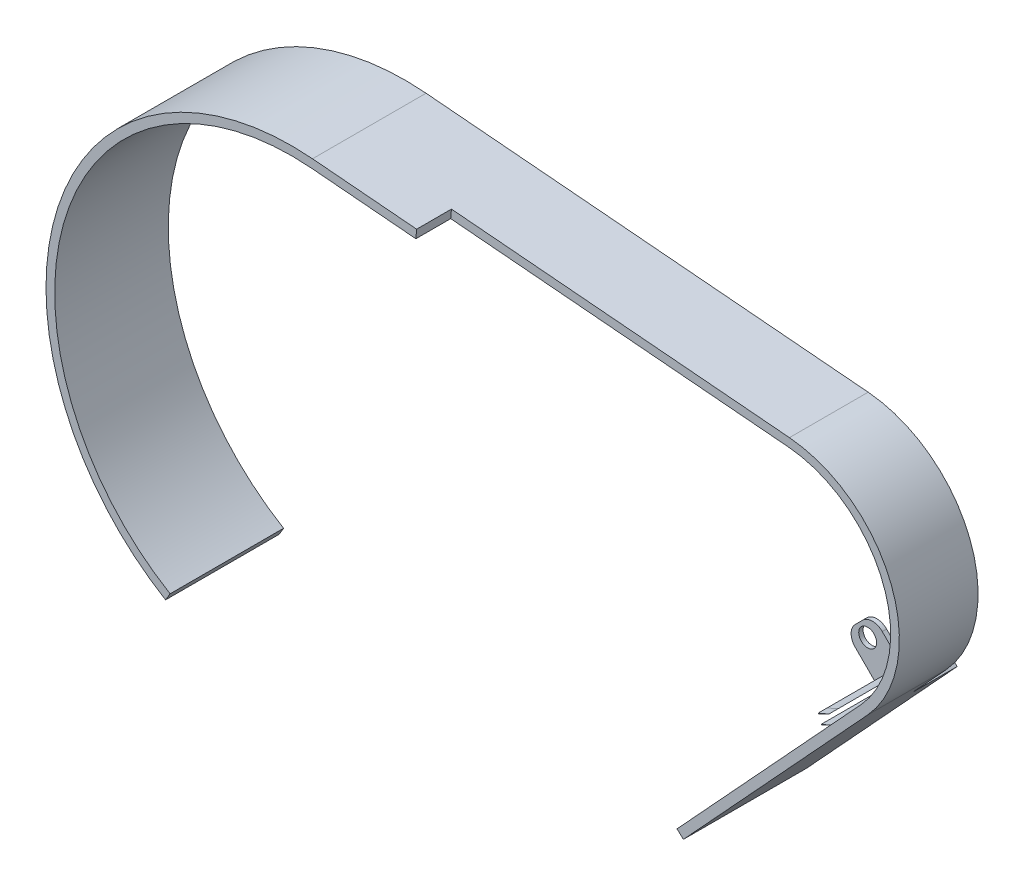
from build123d import *

# Parameters (mm, degrees)
BOSS_EXTRUDE1_DEPTH   = 25.4
BOSS_EXTRUDE1_2_DEPTH = 25.4
SKETCH2_R             = 7.0739
SKETCH2_R_2           = 3.2639
BOSS_EXTRUDE2_DEPTH   = 3.175
BOSS_EXTRUDE3_DEPTH   = 3.302
BOSS_EXTRUDE4_DEPTH   = 12.7
BOSS_EXTRUDE5_DEPTH   = 16.1925
SKETCH6_R             = 3.2639
BOSS_EXTRUDE6_DEPTH   = 1.5875
BOSS_EXTRUDE7_DEPTH   = 44.8945


with BuildPart() as part:
    # Sketch1 → Boss-Extrude1 (new body)
    with BuildSketch(Plane.XY):
        with BuildLine():
            ThreePointArc((70.001721328, 21.116929737), (32.109818913, 121.760822938), (121.667937999, 181.295122405))
            Line((121.667937999, 181.295122405), (282.867264941, 167.491822308))
            ThreePointArc((282.867264941, 167.491822308), (317.285019746, 141.708326855), (309.281467912, 99.455354869))
            Line((309.281467912, 99.455354869), (298.182872237, 87.415180491))
            ThreePointArc((298.182872237, 87.415180491), (296.481974793, 86.652009193), (294.750152503, 85.961883046))
            Line((294.750152503, 85.961883046), (294.839214659, 85.723778364))
            Line((294.839214659, 85.723778364), (298.161838441, 87.392362238))
            Line((298.161838441, 87.392362238), (274.850661498, 62.103519979))
            Line((274.850661498, 62.103519979), (277.185151179, 59.951594578))
            Line((277.185151179, 59.951594578), (311.615957593, 97.303429468))
            ThreePointArc((311.615957593, 97.303429468), (320.244786914, 142.85741489), (283.138145015, 170.655245926))
            Line((283.138145015, 170.655245926), (121.938818073, 184.458546023))
            ThreePointArc((121.938818073, 184.458546023), (29.088121079, 122.735485546), (68.373108141, 18.391449213))
            Line((68.373108141, 18.391449213), (70.001721328, 21.116929737))
        make_face()
    extrude(amount=BOSS_EXTRUDE1_DEPTH)

    # Sketch2 → Boss-Extrude2 (add)
    # profile 1 of 2: a face of its own
    with BuildSketch(Plane(origin=(0, 0, 0), x_dir=(-1, 0, 0), z_dir=(0, 0, -1))):
        with BuildLine():
            ThreePointArc((-36.587701927, 50.782990283), (-44.384911147, 39.317928918), (-53.858754358, 29.194174745))
            Line((-53.858754358, 29.194174745), (-22.316186857, 12.775282108))
            ThreePointArc((-22.316186857, 12.775282108), (-23.932636358, 13.931413925), (-25.163710326, 15.491544259))
            ThreePointArc((-25.163710326, 15.491544259), (-23.930769686, 24.17036605), (-15.202863294, 24.986295173))
            ThreePointArc((-15.202863294, 24.986295173), (-14.373460165, 24.357545231), (-13.645291854, 23.613900861))
            Line((-13.645291854, 23.613900861), (-36.587701927, 50.782990283))
        make_face()
    # profile 2 of 2: a face of its own
    with BuildSketch(Plane(origin=(0, 0, 0), x_dir=(-1, 0, 0), z_dir=(0, 0, -1))):
        with Locations((-19.05, 19.05)):
            Circle(SKETCH2_R)
        with Locations((-19.05, 19.05)):
            Circle(SKETCH2_R_2, mode=Mode.SUBTRACT)
    extrude(amount=-BOSS_EXTRUDE2_DEPTH)

    # Sketch3 → Boss-Extrude3 (add)
    with BuildSketch(Plane.XY.offset(25.4)):
        with BuildLine():
            Line((68.373108141, 18.391449213), (70.001721328, 21.116929737))
            ThreePointArc((70.001721328, 21.116929737), (32.109818913, 121.760822938), (121.667937999, 181.295122405))
            Line((121.667937999, 181.295122405), (282.867264941, 167.491822308))
            ThreePointArc((282.867264941, 167.491822308), (317.285019746, 141.708326855), (309.281467912, 99.455354869))
            Line((309.281467912, 99.455354869), (298.182872237, 87.415180491))
            ThreePointArc((298.182872237, 87.415180491), (296.481974793, 86.652009193), (294.750152503, 85.961883046))
            Line((294.750152503, 85.961883046), (294.839214659, 85.723778364))
            Line((294.839214659, 85.723778364), (298.161838441, 87.392362238))
            Line((298.161838441, 87.392362238), (274.850661498, 62.103519979))
            Line((274.850661498, 62.103519979), (277.185151179, 59.951594578))
            Line((277.185151179, 59.951594578), (311.615957593, 97.303429468))
            ThreePointArc((311.615957593, 97.303429468), (320.244786914, 142.85741489), (283.138145015, 170.655245926))
            Line((283.138145015, 170.655245926), (121.938818073, 184.458546023))
            ThreePointArc((121.938818073, 184.458546023), (29.088121079, 122.735485546), (68.373108141, 18.391449213))
        make_face()
        with BuildLine():
            Line((293.637822612, 88.935659637), (293.720430988, 88.714808918))
            Line((293.720430988, 88.714808918), (297.638321365, 90.682328905))
            ThreePointArc((297.638321365, 90.682328905), (295.661540372, 89.755243259), (293.637822612, 88.935659637))
        make_face()
    extrude(amount=BOSS_EXTRUDE3_DEPTH)


with BuildPart() as body_2:
    # Sketch1 → Boss-Extrude1 2 (new body)
    with BuildSketch(Plane.XY):
        with BuildLine():
            ThreePointArc((297.638321365, 90.682328905), (295.661540372, 89.755243259), (293.637822612, 88.935659637))
            Line((293.637822612, 88.935659637), (293.720430988, 88.714808918))
            Line((293.720430988, 88.714808918), (297.638321365, 90.682328905))
        make_face()
    extrude(amount=BOSS_EXTRUDE1_2_DEPTH)


with BuildPart() as boss_extrude3_piece_1:
    # of the separate pieces the step leaves, piece 1, a body of its own (boss_extrude3_pieces)
    add(part.part.solids().sort_by_distance((70.001721328, 21.116929737, 28.702))[0])

    # Sketch4 → Boss-Extrude4 (add)
    with BuildSketch(Plane.XY.offset(28.702)):
        with BuildLine():
            Line((121.667937999, 181.295122405), (159.629021413, 178.044561523))
            Line((159.629021413, 178.044561523), (159.899901487, 181.207985141))
            Line((159.899901487, 181.207985141), (121.938818073, 184.458546023))
            ThreePointArc((121.938818073, 184.458546023), (29.088121079, 122.735485546), (68.373108141, 18.391449213))
            Line((68.373108141, 18.391449213), (70.001721328, 21.116929737))
            ThreePointArc((70.001721328, 21.116929737), (32.109818913, 121.760822938), (121.667937999, 181.295122405))
        make_face()
    extrude(amount=BOSS_EXTRUDE4_DEPTH)

    # Sketch5 → Boss-Extrude5 (add)
    with BuildSketch(Plane(origin=(0, 0, 0), x_dir=(-1, 0, 0), z_dir=(0, 0, -1))):
        Polygon((-277.185151179, 59.951594578), (-274.850661498, 62.103519979), (-297.070096233, 86.207999194), (-299.404585914, 84.056073793), align=None)
    extrude(amount=BOSS_EXTRUDE5_DEPTH)

    # Sketch6 → Boss-Extrude6 (add)
    with BuildSketch(Plane(origin=(0, 0, -16.1925), x_dir=(-1, 0, 0), z_dir=(0, 0, -1))):
        with BuildLine():
            Line((-274.850661498, 62.103519979), (-263.801215322, 73.152966154))
            ThreePointArc((-263.801215322, 73.152966154), (-262.313317771, 76.745068603), (-263.801215322, 80.337171051))
            Line((-263.801215322, 80.337171051), (-266.495292159, 83.031247888))
            ThreePointArc((-266.495292159, 83.031247888), (-270.087394607, 84.519145439), (-273.679497055, 83.031247888))
            Line((-273.679497055, 83.031247888), (-284.326969415, 72.383775528))
            Line((-284.326969415, 72.383775528), (-274.850661498, 62.103519979))
        make_face()
        with Locations((-268.354205176, 78.478258034)):
            Circle(SKETCH6_R, mode=Mode.SUBTRACT)
    extrude(amount=-BOSS_EXTRUDE6_DEPTH)

    # Sketch7 → Boss-Extrude7 (add)
    with BuildSketch(Plane(origin=(0, 0, -16.1925), x_dir=(-1, 0, 0), z_dir=(0, 0, -1))):
        Polygon((-277.185151179, 59.951594578), (-244.475885085, 24.467351432), (-242.141395404, 26.619276833), (-274.850661498, 62.103519979), align=None)
    extrude(amount=-BOSS_EXTRUDE7_DEPTH)


with BuildPart() as boss_extrude3_piece_2:
    # of the separate pieces the step leaves, piece 2, a body of its own (boss_extrude3_pieces)
    add(part.part.solids().sort_by_distance((293.637822612, 88.935659637, 25.4))[0])


solid = Compound([body_2.part, boss_extrude3_piece_1.part, boss_extrude3_piece_2.part])
